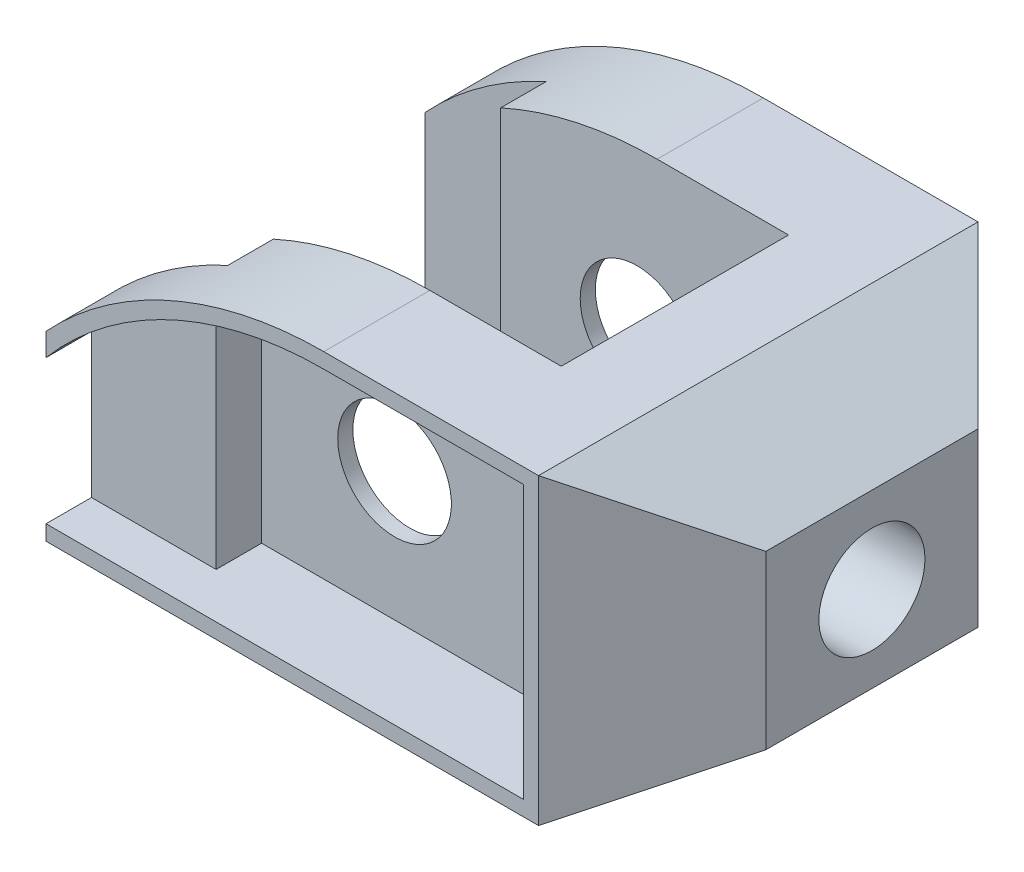
from build123d import *

# Parameters (mm, degrees)
SKETCH1_R           = 7.5
BOSS_EXTRUDE1_DEPTH = 58
CUT_EXTRUDE1_DEPTH  = 107.60206377
SKETCH3_R           = 7
CUT_EXTRUDE2_DEPTH  = 107.60206377
CUT_EXTRUDE3_DEPTH  = 6
CUT_EXTRUDE4_START  = -12
SKETCH4_3_R         = 7.5
CUT_EXTRUDE4_DEPTH  = 12


with BuildPart() as part:
    # Sketch1 → Boss-Extrude1 (new body)
    with BuildSketch(Plane.XY):
        with BuildLine():
            Line((0, 0), (65, 0))
            Line((65, 0), (80, 8.660254038))
            Line((80, 8.660254038), (80, 31.339745962))
            Line((80, 31.339745962), (65, 40))
            Line((65, 40), (36.66060556, 40))
            ThreePointArc((36.66060556, 40), (16.66060556, 35.82575695), (0, 24))
            Line((0, 24), (0, 0))
        make_face()
        with Locations((34, 19)):
            Circle(SKETCH1_R, mode=Mode.SUBTRACT)
    extrude(amount=BOSS_EXTRUDE1_DEPTH)

    # Sketch2 → Cut-Extrude1 (cut, through all)
    with BuildSketch(Plane(origin=(0, 40, 0), x_dir=(1, 0, 0), z_dir=(0, 1, 0))):
        Polygon((16, -8), (0, -8), (0, -50), (16, -50), (16, -44), (54, -44), (54, -14), (16, -14), align=None)
        Polygon((80, 0), (65, 0), (80, -15), align=None)
        Polygon((80, -58), (80, -43), (65, -58), align=None)
    extrude(amount=-CUT_EXTRUDE1_DEPTH, mode=Mode.SUBTRACT)

    # Sketch3 → Cut-Extrude2 (cut, through all)
    with BuildSketch(Plane(origin=(80, 0, 0), x_dir=(0, 0, -1), z_dir=(1, 0, 0))):
        with Locations((-29, 20)):
            Circle(SKETCH3_R)
    extrude(amount=-CUT_EXTRUDE2_DEPTH, mode=Mode.SUBTRACT)

    # Sketch4 → Cut-Extrude3 (cut)
    with BuildSketch(Plane.XY.offset(58)):
        with BuildLine():
            Line((16.452013389, 2), (16.452013389, 33.538635744))
            ThreePointArc((16.452013389, 33.538635744), (8.428320966, 28.819300697), (1.466424222, 22.64))
            ThreePointArc((1.466424222, 22.64), (0.7236706, 21.820381922), (0, 20.98386677))
            Line((0, 20.98386677), (0, 2))
            Line((0, 2), (16.452013389, 2))
        make_face()
    cut_extrude3 = extrude(amount=-CUT_EXTRUDE3_DEPTH, mode=Mode.SUBTRACT)

    # Sketch4<3> → Cut-Extrude4 (cut)
    with BuildSketch(Plane.XY.offset(58).offset(CUT_EXTRUDE4_START)):
        with BuildLine():
            ThreePointArc((36.66060556, 38), (26.3130096, 36.871390612), (16.452013389, 33.538635744))
            Line((16.452013389, 33.538635744), (16.452013389, 2))
            Line((16.452013389, 2), (63, 2))
            Line((63, 2), (63, 38))
            Line((63, 38), (36.66060556, 38))
        make_face()
        with Locations((34, 19)):
            Circle(SKETCH4_3_R, mode=Mode.SUBTRACT)
    cut_extrude4 = extrude(amount=CUT_EXTRUDE4_DEPTH, mode=Mode.SUBTRACT)

    # Mirror1: Cut-Extrude3, Cut-Extrude4 across plane
    add(cut_extrude3.mirror(Plane.XY.offset(29)), mode=Mode.SUBTRACT)
    add(cut_extrude4.mirror(Plane.XY.offset(29)), mode=Mode.SUBTRACT)


solid = part.part
